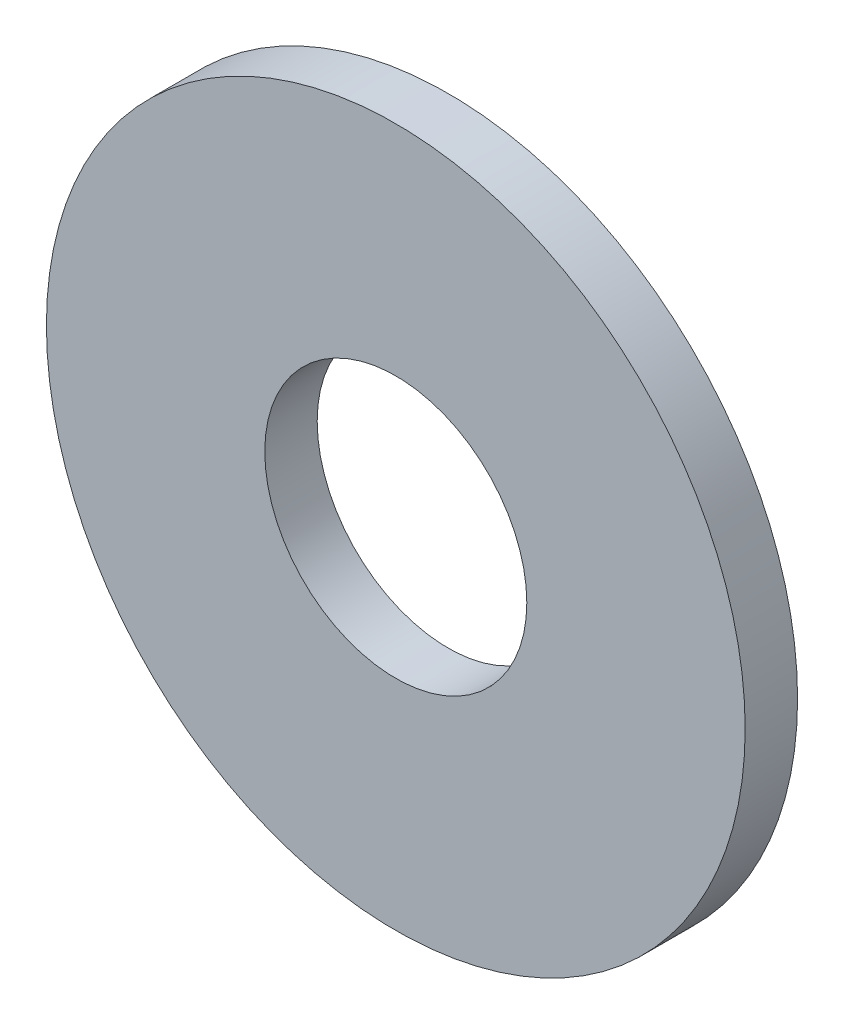
from build123d import *

# Parameters (mm, degrees)
SKETCH_1_R      = 8
SKETCH_1_R_2    = 3
EXTRUDE_1_DEPTH = 1.2


with BuildPart() as part:
    # 草图1 → 凸台-拉伸1 (new body)
    with BuildSketch(Plane.XY):
        Circle(SKETCH_1_R)
        Circle(SKETCH_1_R_2, mode=Mode.SUBTRACT)
    extrude(amount=EXTRUDE_1_DEPTH)


solid = part.part
